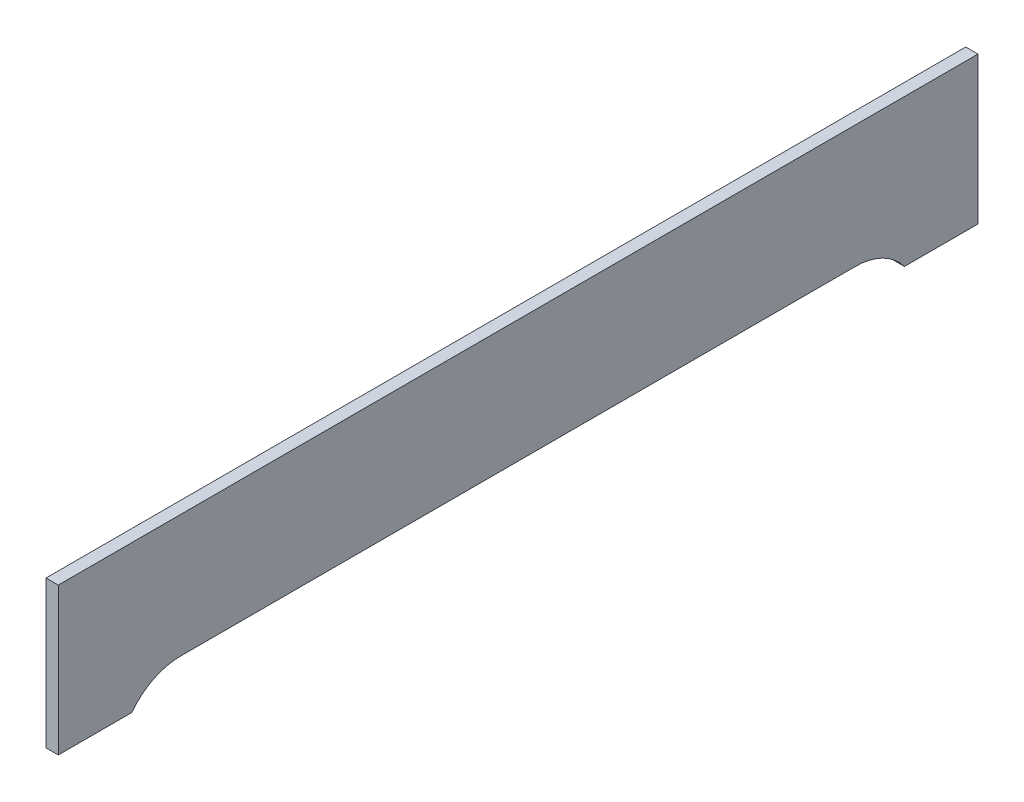
from build123d import *

# Parameters (mm, degrees)
BOSS_EXTRUDE1_DEPTH = 5


with BuildPart() as part:
    # Sketch1 → Boss-Extrude1 (new body)
    with BuildSketch(Plane(origin=(0, 0, 0), x_dir=(0, 0, -1), z_dir=(1, 0, 0))):
        with BuildLine():
            Line((0, 0), (0, -10))
            Line((0, -10), (30, -10))
            ThreePointArc((30, -10), (38.819660113, -2.639320225), (50, 0))
            Line((50, 0), (325, 0))
            ThreePointArc((325, 0), (336.180339887, -2.639320225), (345, -10))
            Line((345, -10), (375, -10))
            Line((375, -10), (375, 0))
            Line((375, 0), (375, 50))
            Line((375, 50), (0, 50))
            Line((0, 50), (0, 0))
        make_face()
    extrude(amount=BOSS_EXTRUDE1_DEPTH)


solid = part.part
